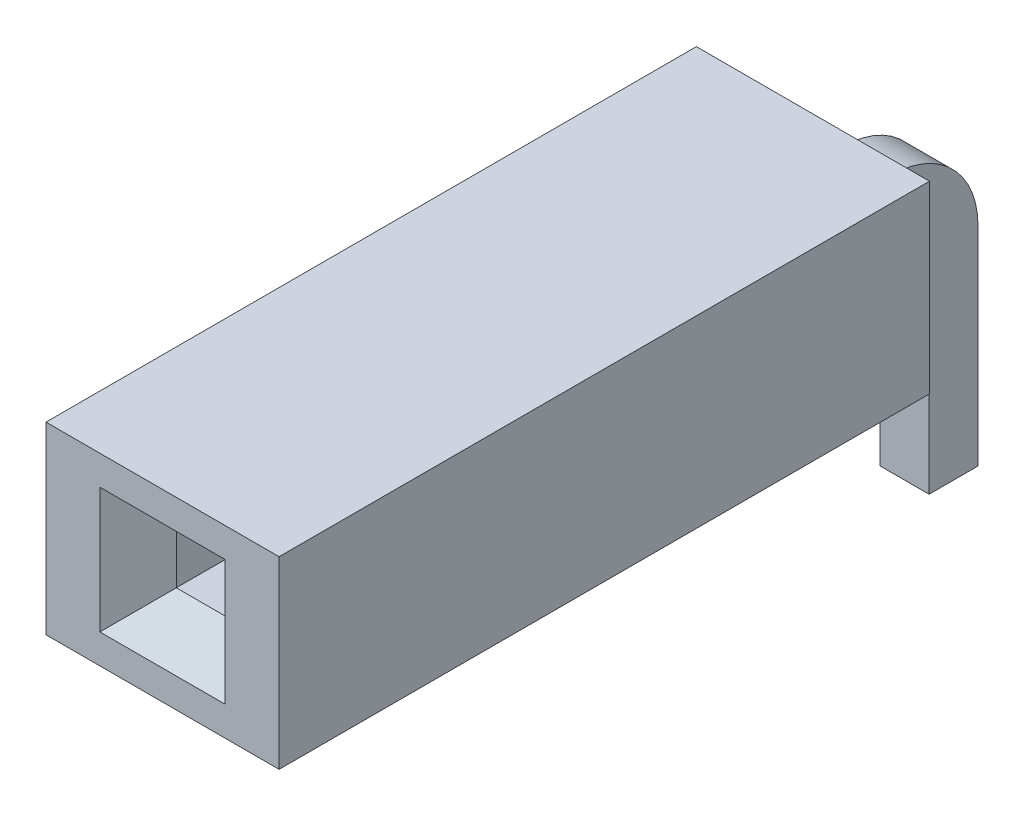
from build123d import *
from OCP.BRepFilletAPI import BRepFilletAPI_MakeFillet

# Parameters (mm, degrees)
SKETCH1_W           = 3.05
SKETCH1_H           = 2.41
BOSS_EXTRUDE1_DEPTH = 8.51
CUT_EXTRUDE1_START  = 8.51
SKETCH1_3_W         = 0.64
SKETCH1_3_H         = 0.64
CUT_EXTRUDE1_DEPTH  = 5
CHAMFER1_SIZE       = 0.5
BOSS_EXTRUDE2_DEPTH = 0.32
FILLET1_R1          = 0.5
FILLET1_R2          = 1.14
CHAMFER2_SIZE       = 0.2


with BuildPart() as part:
    # Sketch1 → Boss-Extrude1 (new body)
    with BuildSketch(Plane.XY):
        Rectangle(SKETCH1_W, SKETCH1_H)
    extrude(amount=BOSS_EXTRUDE1_DEPTH)

    # Sketch1<3> → Cut-Extrude1 (cut)
    with BuildSketch(Plane.XY.offset(CUT_EXTRUDE1_START)):
        Rectangle(SKETCH1_3_W, SKETCH1_3_H)
    extrude(amount=-CUT_EXTRUDE1_DEPTH, mode=Mode.SUBTRACT)

    # Chamfer1
    chamfer1_edges = [part.edges().sort_by_distance(p)[0] for p in [
        (-0.32, 0, 8.51),
        (0, -0.32, 8.51),
        (0.32, 0, 8.51),
        (0, 0.32, 8.51),
    ]]
    chamfer(chamfer1_edges, length=CHAMFER1_SIZE)

    # Sketch2 → Boss-Extrude2 (add, symmetric)
    with BuildSketch(Plane(origin=(0, 0, 0), x_dir=(0, 0, -1), z_dir=(1, 0, 0))):
        Polygon((0, -0.32), (1.2, -0.32), (1.2, -3.745), (1.84, -3.745), (1.84, 0.32), (0, 0.32), align=None)
    extrude(amount=BOSS_EXTRUDE2_DEPTH, both=True)

    # Fillet1: one fillet with a radius per group of edges: ONE call of the kernel's fillet builder (fillet() takes one radius for all edges)
    fillet1_edges_1 = [part.edges().sort_by_distance(p)[0] for p in [
        (0, -0.32, -1.2),
    ]]
    fillet1_edges_2 = [part.edges().sort_by_distance(p)[0] for p in [
        (0, 0.32, -1.84),
    ]]
    fillet1 = BRepFilletAPI_MakeFillet(part.part.solid().wrapped)
    for e in fillet1_edges_1:
        fillet1.Add(FILLET1_R1, e.wrapped)
    for e in fillet1_edges_2:
        fillet1.Add(FILLET1_R2, e.wrapped)
    add(Compound.cast(fillet1.Shape()), mode=Mode.REPLACE)

    # Chamfer2
    chamfer2_edges = [part.edges().sort_by_distance(p)[0] for p in [
        (-0.32, -3.745, -1.52),
        (0, -3.745, -1.2),
        (0, -3.745, -1.84),
        (0.32, -3.745, -1.52),
    ]]
    chamfer(chamfer2_edges, length=CHAMFER2_SIZE)


solid = part.part
